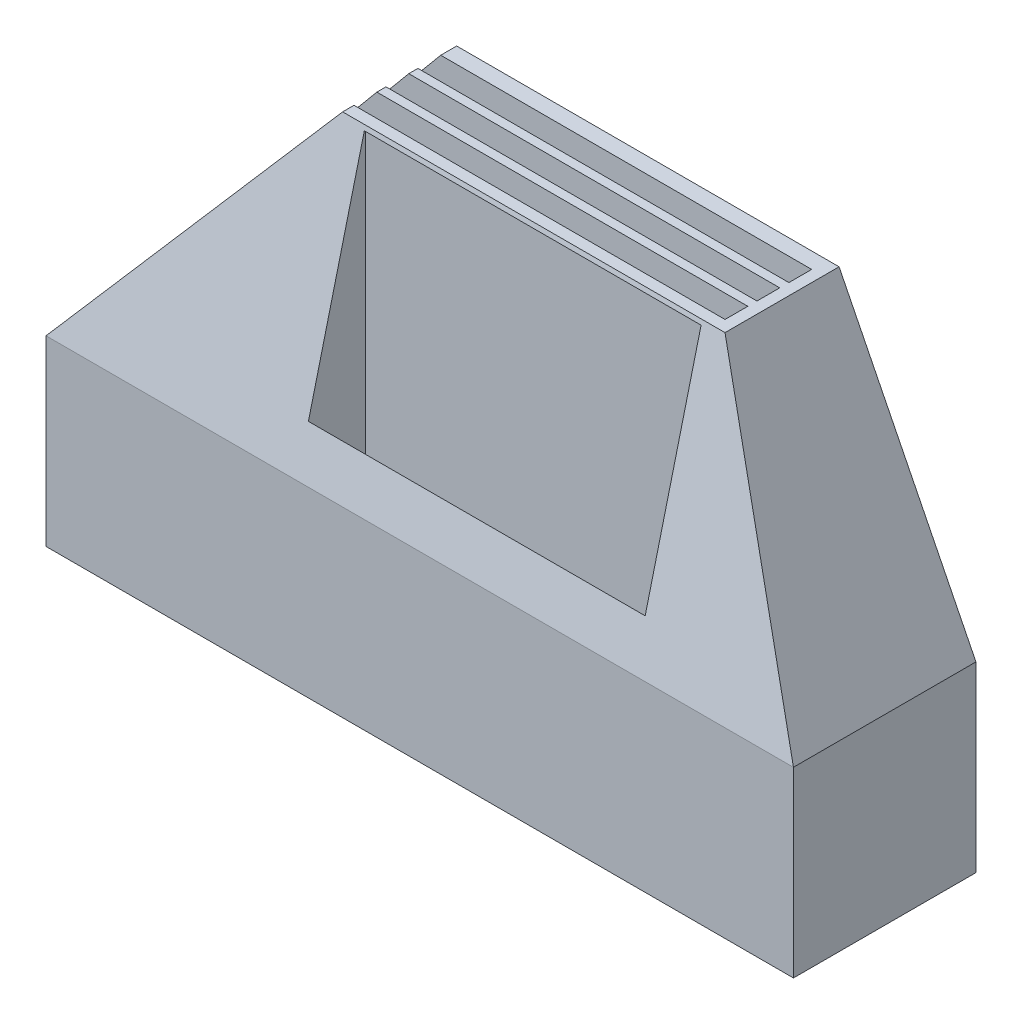
from build123d import *

# Parameters (mm, degrees)
SKETCH1_W           = 416.08
SKETCH1_H           = 101.6
BOSS_EXTRUDE2_DEPTH = 254
CUT_EXTRUDE1_DEPTH  = 101.6
SKETCH6_W           = 187.48
SKETCH6_H           = 31.75
CUT_EXTRUDE9_DEPTH  = 251.554
SKETCH8_W           = 327.18
SKETCH8_H           = 12.7
CUT_EXTRUDE11_DEPTH = 228.6
CUT_EXTRUDE12_DEPTH = 498.956952356
CUT_EXTRUDE13_REACH = 493.6
SKETCH10_W          = 162.08
SKETCH10_H          = 13.204649201


with BuildPart() as part:
    # Sketch1 → Boss-Extrude2 (new body)
    with BuildSketch(Plane(origin=(0, 0, 0), x_dir=(1, 0, 0), z_dir=(0, 1, 0))):
        with Locations((208.04, 50.8)):
            Rectangle(SKETCH1_W, SKETCH1_H)
    extrude(amount=BOSS_EXTRUDE2_DEPTH)

    # Sketch2 → Cut-Extrude1 (cut)
    with BuildSketch(Plane.XY):
        Polygon((0, 101.6), (0, 254), (127, 254), align=None)
        Polygon((416.08, 254), (416.08, 101.6), (339.88, 254), align=None)
    extrude(amount=-CUT_EXTRUDE1_DEPTH, mode=Mode.SUBTRACT)

    # Sketch6 → Cut-Extrude9 (cut)
    with BuildSketch(Plane(origin=(0, 0, 0), x_dir=(1, 0, 0), z_dir=(0, 1, 0))):
        with Locations((233.44, 22.225)):
            Rectangle(SKETCH6_W, SKETCH6_H)
    extrude(amount=CUT_EXTRUDE9_DEPTH, mode=Mode.SUBTRACT)

    # Sketch8 → Cut-Extrude11 (cut)
    with BuildSketch(Plane(origin=(0, 254, 0), x_dir=(1, 0, 0), z_dir=(0, 1, 0))):
        with Locations((169.94, 50.8)):
            Rectangle(SKETCH8_W, SKETCH8_H)
        with Locations((169.94, 68.58)):
            Rectangle(SKETCH8_W, SKETCH8_H)
        with Locations((169.94, 86.36)):
            Rectangle(SKETCH8_W, SKETCH8_H)
    extrude(amount=-CUT_EXTRUDE11_DEPTH, mode=Mode.SUBTRACT)

    # Sketch9 → Cut-Extrude12 (cut, through all)
    with BuildSketch(Plane(origin=(416.08, 0, 0), x_dir=(0, 0, -1), z_dir=(1, 0, 0))):
        Polygon((0, 254), (0, 101.6), (38.1, 254), align=None)
    extrude(amount=-CUT_EXTRUDE12_DEPTH, mode=Mode.SUBTRACT)

    # Sketch10 → Cut-Extrude13 (cut, up to next)
    with BuildSketch(Plane.XY.offset(-38.1), mode=Mode.PRIVATE) as cut_extrude13_sk1:
        with Locations((233.44, 17.056383054)):
            Rectangle(SKETCH10_W, SKETCH10_H)
    cut_extrude13_tool1 = extrude(cut_extrude13_sk1.sketch, amount=-CUT_EXTRUDE13_REACH, mode=Mode.PRIVATE) & part.part
    add(cut_extrude13_tool1.solids().sort_by_distance((233.44, 17.056383, -38.1))[0], mode=Mode.SUBTRACT)


solid = part.part
